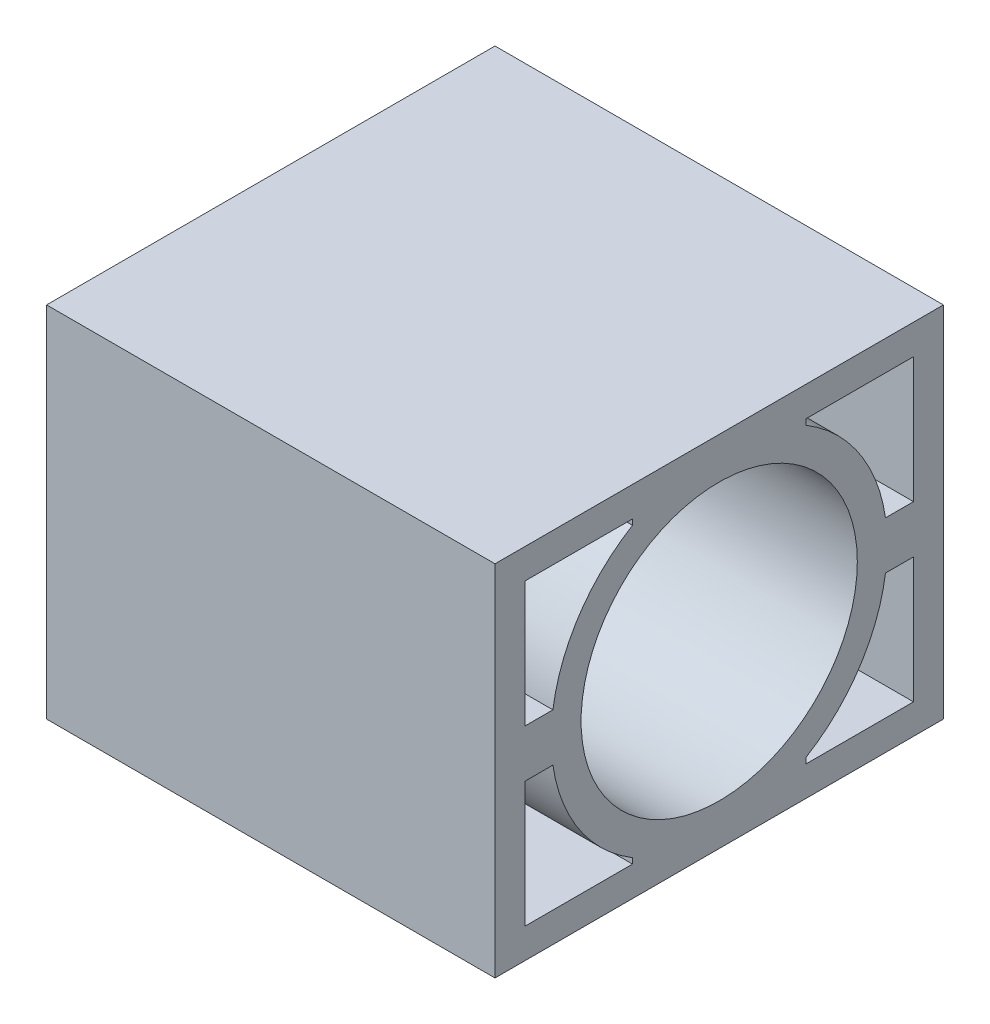
from build123d import *

# Parameters (mm, degrees)
SKETCH1_W           = 75
SKETCH1_H           = 60
BOSS_EXTRUDE1_DEPTH = 75
SKETCH2_R           = 23.1
CUT_EXTRUDE1_DEPTH  = 70
SKETCH3_R           = 2.25
CUT_EXTRUDE2_DEPTH  = 90.057565653
CUT_EXTRUDE3_REACH  = 105.108
SKETCH4_R           = 2.25


with BuildPart() as part:
    # Sketch1 → Boss-Extrude1 (new body)
    with BuildSketch(Plane(origin=(0, 0, 0), x_dir=(0, 0, -1), z_dir=(1, 0, 0))):
        Rectangle(SKETCH1_W, SKETCH1_H)
    extrude(amount=BOSS_EXTRUDE1_DEPTH)

    # Sketch2 → Cut-Extrude1 (cut)
    with BuildSketch(Plane(origin=(75, 0, 0), x_dir=(0, 0, -1), z_dir=(1, 0, 0))):
        Circle(SKETCH2_R)
    extrude(amount=-CUT_EXTRUDE1_DEPTH, mode=Mode.SUBTRACT)

    # Sketch3 → Cut-Extrude2 (cut, through all)
    with BuildSketch(Plane.ZY):
        with Locations((-12.374368671, 12.374368671)):
            Circle(SKETCH3_R)
        with Locations((12.374368671, 12.374368671)):
            Circle(SKETCH3_R)
        with Locations((12.374368671, -12.374368671)):
            Circle(SKETCH3_R)
        with Locations((-12.374368671, -12.374368671)):
            Circle(SKETCH3_R)
        with BuildLine():
            Line((-5.07937004, 12.4), (5.07937004, 12.4))
            ThreePointArc((5.07937004, 12.4), (13.4, 0), (5.07937004, -12.4))
            Line((5.07937004, -12.4), (-5.07937004, -12.4))
            ThreePointArc((-5.07937004, -12.4), (-13.4, 0), (-5.07937004, 12.4))
        make_face()
        with BuildLine():
            Line((32.5, -25), (14.5, -25))
            Line((14.5, -25), (14.5, -24.069898213))
            ThreePointArc((14.5, -24.069898213), (23.416139376, -15.533654327), (27.813845473, -4))
            Line((27.813845473, -4), (32.5, -4))
            Line((32.5, -4), (32.5, -25))
        make_face()
        with BuildLine():
            Line((32.5, 25), (14.5, 25))
            Line((14.5, 25), (14.5, 24.069898213))
            ThreePointArc((14.5, 24.069898213), (23.416139376, 15.533654327), (27.813845473, 4))
            Line((27.813845473, 4), (32.5, 4))
            Line((32.5, 4), (32.5, 25))
        make_face()
        with BuildLine():
            Line((-32.5, -25), (-32.5, -4))
            Line((-32.5, -4), (-27.813845473, -4))
            ThreePointArc((-27.813845473, -4), (-23.416139376, -15.533654327), (-14.5, -24.069898213))
            Line((-14.5, -24.069898213), (-14.5, -25))
            Line((-14.5, -25), (-32.5, -25))
        make_face()
        with BuildLine():
            Line((-32.5, 4), (-27.813845473, 4))
            ThreePointArc((-27.813845473, 4), (-23.416139376, 15.533654327), (-14.5, 24.069898213))
            Line((-14.5, 24.069898213), (-14.5, 25))
            Line((-14.5, 25), (-32.5, 25))
            Line((-32.5, 25), (-32.5, 4))
        make_face()
    extrude(amount=-CUT_EXTRUDE2_DEPTH, mode=Mode.SUBTRACT)

    # Sketch4 → Cut-Extrude3 (cut, up to next)
    with BuildSketch(Plane.XZ.offset(30), mode=Mode.PRIVATE) as cut_extrude3_sk1:
        with Locations(Location((60, 27, 0), (0, 0, 270))):
            Circle(SKETCH4_R)
    cut_extrude3_tool1 = extrude(cut_extrude3_sk1.sketch, amount=-CUT_EXTRUDE3_REACH, mode=Mode.PRIVATE) & part.part
    # Sketch4 → Cut-Extrude3 (cut, up to next)
    with BuildSketch(Plane.XZ.offset(30), mode=Mode.PRIVATE) as cut_extrude3_sk2:
        with Locations(Location((15, 27, 0), (0, 0, 270))):
            Circle(SKETCH4_R)
    cut_extrude3_tool2 = extrude(cut_extrude3_sk2.sketch, amount=-CUT_EXTRUDE3_REACH, mode=Mode.PRIVATE) & part.part
    # Sketch4 → Cut-Extrude3 (cut, up to next)
    with BuildSketch(Plane.XZ.offset(30), mode=Mode.PRIVATE) as cut_extrude3_sk3:
        with Locations(Location((60, -27, 0), (0, 0, 270))):
            Circle(SKETCH4_R)
    cut_extrude3_tool3 = extrude(cut_extrude3_sk3.sketch, amount=-CUT_EXTRUDE3_REACH, mode=Mode.PRIVATE) & part.part
    # Sketch4 → Cut-Extrude3 (cut, up to next)
    with BuildSketch(Plane.XZ.offset(30), mode=Mode.PRIVATE) as cut_extrude3_sk4:
        with Locations(Location((15, -27, 0), (0, 0, 270))):
            Circle(SKETCH4_R)
    cut_extrude3_tool4 = extrude(cut_extrude3_sk4.sketch, amount=-CUT_EXTRUDE3_REACH, mode=Mode.PRIVATE) & part.part
    add(cut_extrude3_tool1.solids().sort_by_distance((60, -30, 27))[0], mode=Mode.SUBTRACT)
    add(cut_extrude3_tool2.solids().sort_by_distance((15, -30, 27))[0], mode=Mode.SUBTRACT)
    add(cut_extrude3_tool3.solids().sort_by_distance((60, -30, -27))[0], mode=Mode.SUBTRACT)
    add(cut_extrude3_tool4.solids().sort_by_distance((15, -30, -27))[0], mode=Mode.SUBTRACT)


solid = part.part
